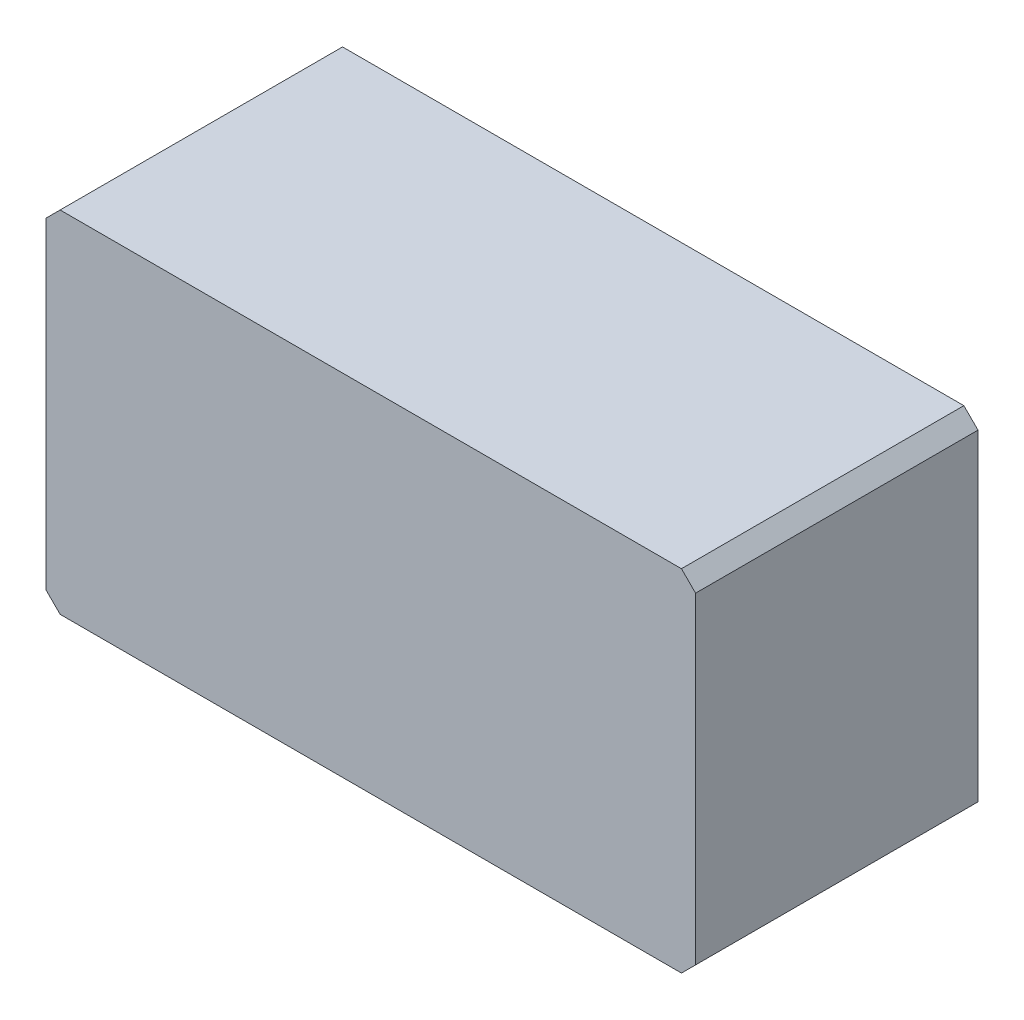
from build123d import *

# Parameters (mm, degrees)
COMPONENT_OUTLINE_DEPTH = 0.5


with BuildPart() as part:
    # 草图1 → Component_Outline (new body)
    with BuildSketch(Plane.XY):
        Polygon((0.55, 0.31), (0.575, 0.285), (0.575, -0.285), (0.55, -0.31), (-0.55, -0.31), (-0.575, -0.285), (-0.575, 0.285), (-0.55, 0.31), align=None)
    extrude(amount=COMPONENT_OUTLINE_DEPTH)


solid = part.part
